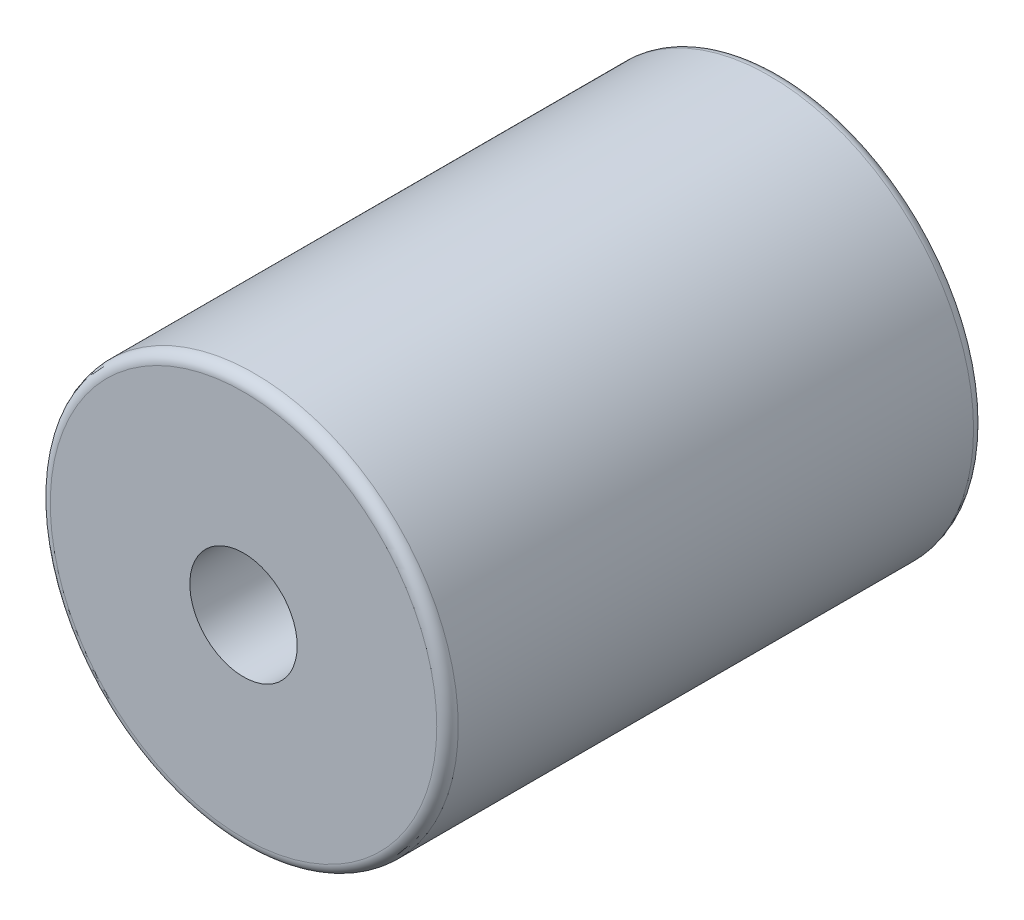
from build123d import *

# Parameters (mm, degrees)
EXTRUDE_1_DEPTH      = 12.5
EXTRUDE_1_DEPTH_BACK = 12.5
SKETCH_1_R           = 9.5
SKETCH_2_R           = 2.5
CUT_EXTRUDE_1_DEPTH  = 8
SKETCH_3_R           = 4
CUT_EXTRUDE_2_DEPTH  = 18
FILLET_1_R           = 0.5
FILLET_2_R           = 0.5


with BuildPart() as part:
    # 草图1 → 凸台-拉伸1 (new, two sides: drawn at the far end of the back side and taken through both)
    with BuildSketch(Plane.XY.offset(-EXTRUDE_1_DEPTH_BACK)):
        Circle(SKETCH_1_R)
    extrude(amount=EXTRUDE_1_DEPTH + EXTRUDE_1_DEPTH_BACK)

    # 草图2 → 切除-拉伸1 (cut)
    with BuildSketch(Plane.XY.offset(12.5)):
        Circle(SKETCH_2_R)
    extrude(amount=-CUT_EXTRUDE_1_DEPTH, mode=Mode.SUBTRACT)

    # 草图3 → 切除-拉伸2 (cut)
    with BuildSketch(Plane(origin=(0, 0, -12.5), x_dir=(-1, 0, 0), z_dir=(0, 0, -1))):
        Circle(SKETCH_3_R)
    extrude(amount=-CUT_EXTRUDE_2_DEPTH, mode=Mode.SUBTRACT)

    # 圆角1
    fillet_1_edges = [part.edges().sort_by_distance(p)[0] for p in [
        (-9.5, 0, -12.5),
    ]]
    fillet(fillet_1_edges, radius=FILLET_1_R)

    # 圆角2
    fillet_2_edges = [part.edges().sort_by_distance(p)[0] for p in [
        (-9.5, 0, 12.5),
    ]]
    fillet(fillet_2_edges, radius=FILLET_2_R)


solid = part.part
